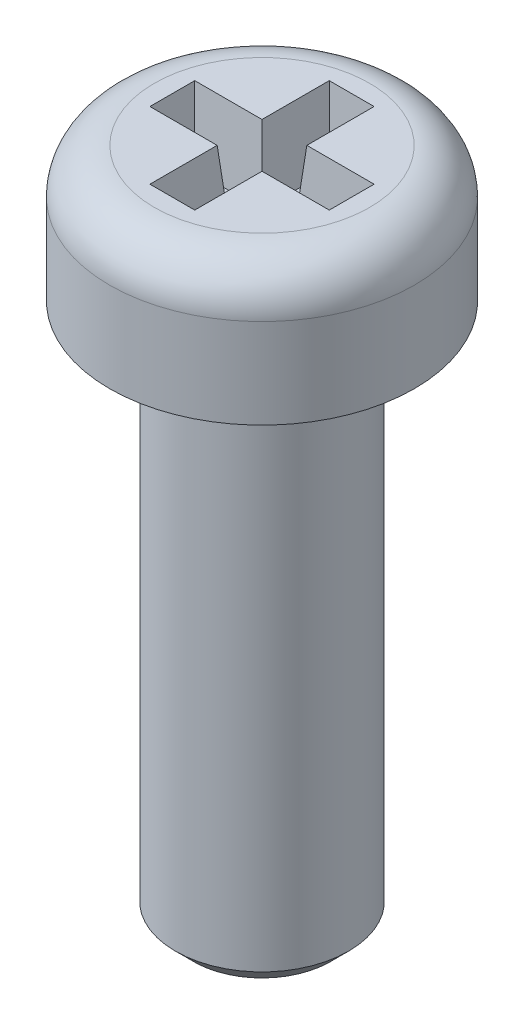
from build123d import *

# Parameters (mm, degrees)
SKETCH1_R                         = 1.7
BOSS_EXTRUDE1_DEPTH               = 1.5
SKETCH2_R                         = 0.965
BOSS_EXTRUDE2_DEPTH               = 6
CHAMFER1_SIZE                     = 0.2
SKETCH3_W                         = 0.5
SKETCH3_H                         = 2
CUT_EXTRUDE_THIN1_DEPTH           = 0.8
CUT_EXTRUDE_THIN1_DRAFT           = -5
SKETCH3_W_2                       = 2
SKETCH3_H_2                       = 0.5
CUT_EXTRUDE_THIN1_PROFILE_2_DEPTH = 0.8
CUT_EXTRUDE_THIN1_PROFILE_2_DRAFT = -5
FILLET1_R                         = 0.5


with BuildPart() as part:
    # Sketch1 → Boss-Extrude1 (new body)
    with BuildSketch(Plane(origin=(0, 0, 0), x_dir=(1, 0, 0), z_dir=(0, 1, 0))):
        Circle(SKETCH1_R)
    extrude(amount=BOSS_EXTRUDE1_DEPTH)

    # Sketch2 → Boss-Extrude2 (add)
    with BuildSketch(Plane.XZ):
        Circle(SKETCH2_R)
    extrude(amount=BOSS_EXTRUDE2_DEPTH)

    # Chamfer1
    chamfer1_edges = [part.edges().sort_by_distance(p)[0] for p in [
        (-0.965, -6, 0),
    ]]
    chamfer(chamfer1_edges, length=CHAMFER1_SIZE)


with BuildPart() as cut_extrude_thin1_tool:
    # Sketch3 → Cut-Extrude-Thin1 (with draft: the straight prism first)
    with BuildSketch(Plane(origin=(0, 1.5, 0), x_dir=(1, 0, 0), z_dir=(0, 1, 0))):
        Rectangle(SKETCH3_W, SKETCH3_H)
    extrude(amount=-CUT_EXTRUDE_THIN1_DEPTH)
    # Cut-Extrude-Thin1: the draft: its side faces are tilted about the plane it starts from
    cut_extrude_thin1_sides = [cut_extrude_thin1_tool.faces().sort_by_distance(p)[0] for p in [
        (0.25, 1.1, 0),
        (0, 1.1, -1),
        (-0.25, 1.1, 0),
        (0, 1.1, 1),
    ]]
    draft(cut_extrude_thin1_sides, Plane(origin=(0, 1.5, 0), x_dir=(1, 0, 0), z_dir=(0, 1, 0)), CUT_EXTRUDE_THIN1_DRAFT)


with BuildPart() as part_1:
    add(part.part)

    # Cut-Extrude-Thin1: cut by cut_extrude_thin1_tool
    add(cut_extrude_thin1_tool.part, mode=Mode.SUBTRACT)


with BuildPart() as cut_extrude_thin1_profile_2_tool:
    # Sketch3 → Cut-Extrude-Thin1 profile 2 (with draft: the straight prism first)
    with BuildSketch(Plane(origin=(0, 1.5, 0), x_dir=(1, 0, 0), z_dir=(0, 1, 0))):
        Rectangle(SKETCH3_W_2, SKETCH3_H_2)
    extrude(amount=-CUT_EXTRUDE_THIN1_PROFILE_2_DEPTH)
    # Cut-Extrude-Thin1 profile 2: the draft: its side faces are tilted about the plane it starts from
    cut_extrude_thin1_profile_2_sides = [cut_extrude_thin1_profile_2_tool.faces().sort_by_distance(p)[0] for p in [
        (0, 1.1, 0.25),
        (1, 1.1, 0),
        (0, 1.1, -0.25),
        (-1, 1.1, 0),
    ]]
    draft(cut_extrude_thin1_profile_2_sides, Plane(origin=(0, 1.5, 0), x_dir=(1, 0, 0), z_dir=(0, 1, 0)), CUT_EXTRUDE_THIN1_PROFILE_2_DRAFT)


with BuildPart() as part_2:
    add(part_1.part)

    # Cut-Extrude-Thin1 profile 2: cut by cut_extrude_thin1_profile_2_tool
    add(cut_extrude_thin1_profile_2_tool.part, mode=Mode.SUBTRACT)

    # Fillet1
    fillet1_edges = [part_2.edges().sort_by_distance(p)[0] for p in [
        (-1.7, 1.5, 0),
    ]]
    fillet(fillet1_edges, radius=FILLET1_R)


solid = part_2.part
